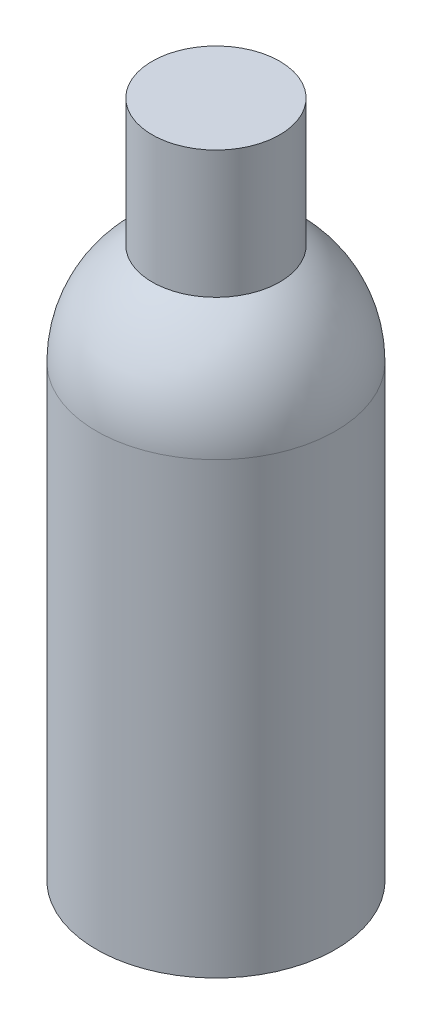
from build123d import *


with BuildPart() as part:
    # Skica1 → Rotovat1 (revolve)
    with BuildSketch(Plane.XY, mode=Mode.PRIVATE) as rotovat1_sk:
        with BuildLine():
            Line((0, 0), (45, 0))
            Line((45, 0), (45, 168.934267379))
            ThreePointArc((45, 168.934267379), (39.40177661, 190.671332498), (24, 207))
            Line((24, 207), (24, 255))
            Line((24, 255), (0, 255))
            Line((0, 255), (0, 0))
        make_face()
    revolve(rotovat1_sk.sketch.rotate(Axis((0, 0, 0), (0, 1, 0)), 90), axis=Axis((0, 0, 0), (0, 1, 0)))


solid = part.part
